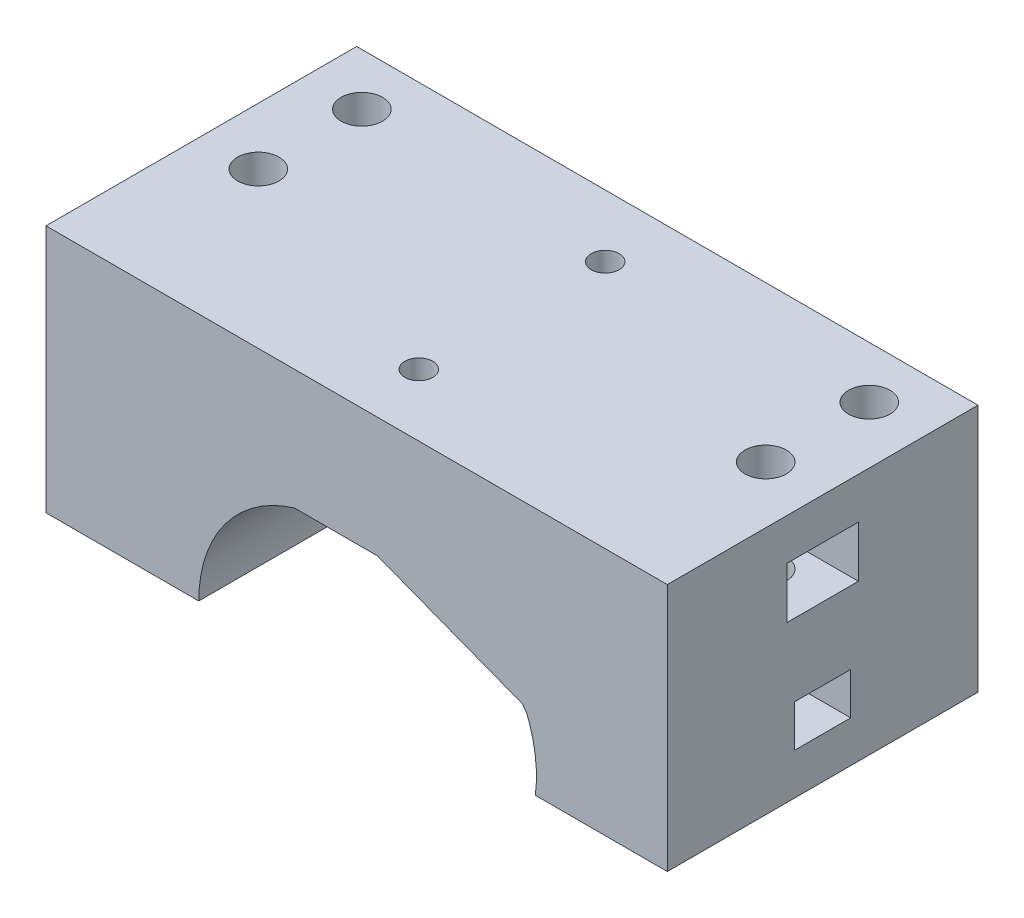
from build123d import *

# Parameters (mm, degrees)
SKETCH_1_W           = 60
SKETCH_1_H           = 34
EXTRUDE_1_DEPTH      = 30
SKETCH_17_W          = 12
SKETCH_17_H          = 23
EXTRUDE_8_DEPTH      = 80
SKETCH_18_R          = 2
CUT_EXTRUDE_7_DEPTH  = 10
CUT_EXTRUDE_8_DEPTH  = 66
SKETCH_20_W          = 4.5
SKETCH_20_H          = 17.2
CUT_EXTRUDE_9_DEPTH  = 8.8
SKETCH_14_R          = 1.6
CUT_EXTRUDE_6_DEPTH  = 103.708324882
EXTRUDE_START        = 7
SKETCH_21_W          = 60
SKETCH_21_H          = 30
SKETCH_21_R          = 1.6
EXTRUDE_9_DEPTH      = 7
SKETCH_22_W          = 36
SKETCH_22_H          = 30
EXTRUDE_10_DEPTH     = 7
SKETCH_27_W          = 12
SKETCH_27_H          = 50
CUT_EXTRUDE_13_DEPTH = 95.768138106
SKETCH_29_W          = 12
SKETCH_29_H          = 16
CUT_EXTRUDE_14_DEPTH = 71.710678119
SKETCH_36_W          = 12
SKETCH_36_H          = 23
CUT_EXTRUDE_21_DEPTH = 50
SKETCH_37_W          = 12
SKETCH_37_H          = 16
CUT_EXTRUDE_22_DEPTH = 59.309518948
SKETCH_38_W          = 60
SKETCH_38_H          = 30
CUT_EXTRUDE_23_DEPTH = 34
SKETCH_41_W          = 6.9
SKETCH_41_H          = 4.95
SKETCH_41_W_2        = 5.41
SKETCH_41_H_2        = 4.05
CUT_EXTRUDE_25_DEPTH = 5.5
CUT_EXTRUDE_26_DEPTH = 49.744230428
SKETCH_43_R          = 1.35
CUT_EXTRUDE_27_DEPTH = 49.7442306
SKETCH_47_R          = 1.9
CUT_EXTRUDE_29_DEPTH = 7
SKETCH_48_R          = 2
CUT_EXTRUDE_30_DEPTH = 10
CUT_EXTRUDE_START    = -4
SKETCH_49_R          = 2
CUT_EXTRUDE_31_DEPTH = 4.9
CUT_EXTRUDE_32_DEPTH = 4.05
CUT_EXTRUDE_33_DEPTH = 4.95
CUT_EXTRUDE_34_REACH = 50.744
SKETCH_53_R          = 2


with BuildPart() as part:
    # 草图1 → 凸台-拉伸1 (new body)
    with BuildSketch(Plane.XY):
        Rectangle(SKETCH_1_W, SKETCH_1_H)
    extrude(amount=EXTRUDE_1_DEPTH)

    # 草图17 → 凸台-拉伸8 (add)
    with BuildSketch(Plane(origin=(0, 0, 0), x_dir=(-1, 0, 0), z_dir=(0, 0, -1))):
        with Locations((24, 28.5)):
            Rectangle(SKETCH_17_W, SKETCH_17_H)
        with Locations((-24, 28.5)):
            Rectangle(SKETCH_17_W, SKETCH_17_H)
    extrude(amount=-EXTRUDE_8_DEPTH)

    # 草图18 → 切除-拉伸7 (cut)
    with BuildSketch(Plane.XY.offset(80)):
        with Locations((24.5, 34)):
            Circle(SKETCH_18_R)
        with Locations((24.5, 24)):
            Circle(SKETCH_18_R)
        with Locations((-24.5, 24)):
            Circle(SKETCH_18_R)
        with Locations((-24.5, 34)):
            Circle(SKETCH_18_R)
    extrude(amount=-CUT_EXTRUDE_7_DEPTH, mode=Mode.SUBTRACT)

    # 草图19 → 切除-拉伸8 (cut)
    with BuildSketch(Plane.XY.offset(30)):
        with BuildLine():
            Line((2, 12.4), (-6, 12.4))
            ThreePointArc((-6, 12.4), (-15.249310993, 0), (-6, -12.4))
            Line((-6, -12.4), (2, -12.4))
            Line((2, -12.4), (16.003706397, -7.024480757))
            ThreePointArc((16.003706397, -7.024480757), (17.250689007, 0), (16.003706397, 7.024480757))
            Line((16.003706397, 7.024480757), (2, 12.4))
        make_face()
    extrude(amount=-CUT_EXTRUDE_8_DEPTH, mode=Mode.SUBTRACT)

    # 草图20 → 切除-拉伸9 (cut)
    with BuildSketch(Plane(origin=(30, 0, 0), x_dir=(0, 0, -1), z_dir=(1, 0, 0))):
        with Locations((-67.75, 28.8)):
            Rectangle(SKETCH_20_W, SKETCH_20_H)
    cut_extrude_9 = extrude(amount=-CUT_EXTRUDE_9_DEPTH, mode=Mode.SUBTRACT)

    # 草图14 → 切除-拉伸6 (cut, through all)
    with BuildSketch(Plane.XZ.offset(17)):
        with Locations(Location((24.5, 15, 0), (0, 0, 270))):
            Circle(SKETCH_14_R)
        with Locations(Location((-24.5, 15, 0), (0, 0, 270))):
            Circle(SKETCH_14_R)
    extrude(amount=-CUT_EXTRUDE_6_DEPTH, mode=Mode.SUBTRACT)

    # 镜向3: 切除-拉伸9 across plane
    add(cut_extrude_9.mirror(Plane(origin=(0, 0, 0), x_dir=(0, 0, 1), z_dir=(1, 0, 0))), mode=Mode.SUBTRACT)

    # 草图21 → 凸台-拉伸9 (add)
    with BuildSketch(Plane.XZ.offset(17).offset(EXTRUDE_START)):
        with Locations((0, 15)):
            Rectangle(SKETCH_21_W, SKETCH_21_H)
        with Locations(Location((24.5, 15, 0), (0, 0, 270))):
            Circle(SKETCH_21_R, mode=Mode.SUBTRACT)
        with Locations(Location((-24.5, 15, 0), (0, 0, 270))):
            Circle(SKETCH_21_R, mode=Mode.SUBTRACT)
    extrude(amount=-EXTRUDE_9_DEPTH)

    # 草图22 → 凸台-拉伸10 (add)
    with BuildSketch(Plane(origin=(0, 17, 0), x_dir=(1, 0, 0), z_dir=(0, 1, 0))):
        with Locations((0, -15)):
            Rectangle(SKETCH_22_W, SKETCH_22_H)
    extrude(amount=EXTRUDE_10_DEPTH)

    # 草图27 → 切除-拉伸13 (cut, through all)
    with BuildSketch(Plane.XZ.offset(-17)):
        with Locations((24, 55)):
            Rectangle(SKETCH_27_W, SKETCH_27_H)
    extrude(amount=-CUT_EXTRUDE_13_DEPTH, mode=Mode.SUBTRACT)

    # 草图29 → 切除-拉伸14 (cut, through all)
    with BuildSketch(Plane.XY.offset(30)):
        with Locations((24, 32)):
            Rectangle(SKETCH_29_W, SKETCH_29_H)
    extrude(amount=-CUT_EXTRUDE_14_DEPTH, mode=Mode.SUBTRACT)

    # 草图36 → 切除-拉伸21 (cut)
    with BuildSketch(Plane.XY.offset(80)):
        with Locations((-24, 28.5)):
            Rectangle(SKETCH_36_W, SKETCH_36_H)
    extrude(amount=-CUT_EXTRUDE_21_DEPTH, mode=Mode.SUBTRACT)

    # 草图37 → 切除-拉伸22 (cut, through all)
    with BuildSketch(Plane.XY.offset(30)):
        with Locations((-24, 32)):
            Rectangle(SKETCH_37_W, SKETCH_37_H)
    extrude(amount=-CUT_EXTRUDE_22_DEPTH, mode=Mode.SUBTRACT)

    # 草图38 → 切除-拉伸23 (cut)
    with BuildSketch(Plane(origin=(0, 0, 0), x_dir=(1, 0, 0), z_dir=(0, 1, 0))):
        with Locations((0, -15)):
            Rectangle(SKETCH_38_W, SKETCH_38_H)
    extrude(amount=-CUT_EXTRUDE_23_DEPTH, mode=Mode.SUBTRACT)

    # 草图41 → 切除-拉伸25 (cut)
    with BuildSketch(Plane(origin=(30, 0, 0), x_dir=(0, 0, -1), z_dir=(1, 0, 0))):
        with Locations((-15, 17.525)):
            Rectangle(SKETCH_41_W, SKETCH_41_H)
        with Locations((-15, 6.025)):
            Rectangle(SKETCH_41_W_2, SKETCH_41_H_2)
    cut_extrude_25 = extrude(amount=-CUT_EXTRUDE_25_DEPTH, mode=Mode.SUBTRACT)

    # 镜向5: 切除-拉伸25 across plane
    add(cut_extrude_25.mirror(Plane(origin=(0, 0, 0), x_dir=(0, 0, 1), z_dir=(1, 0, 0))), mode=Mode.SUBTRACT)

    # 草图42 → 切除-拉伸26 (cut, through all)
    with BuildSketch(Plane.XY.offset(30)):
        with BuildLine():
            Line((16.003706397, 7.024480757), (14.503027832, 1.394480604))
            Line((14.503027832, 1.394480604), (17.250689007, 0))
            add(Edge.make_bspline(
                [(16.44131127, 6.418576517), (17.679905774, 3.26163083), (17.250689007, 0)],
                knots=[0, 0, 0, 1, 1, 1], degree=2))
            Line((16.44131127, 6.418576517), (16.003706397, 7.024480757))
        make_face()
    extrude(amount=-CUT_EXTRUDE_26_DEPTH, mode=Mode.SUBTRACT)

    # 草图43 → 切除-拉伸27 (cut, through all)
    with BuildSketch(Plane(origin=(0, 24, 0), x_dir=(1, 0, 0), z_dir=(0, 1, 0))):
        with Locations(Location((0, -6, 0), (0, 0, 270))):
            Circle(SKETCH_43_R)
        with Locations(Location((0, -24, 0), (0, 0, 180))):
            Circle(SKETCH_43_R)
    extrude(amount=-CUT_EXTRUDE_27_DEPTH, mode=Mode.SUBTRACT)

    # 草图47 → 切除-拉伸29 (cut)
    with BuildSketch(Plane(origin=(0, 24, 0), x_dir=(1, 0, 0), z_dir=(0, 1, 0))):
        with Locations(Location((-24.5, -15, 0), (0, 0, 270))):
            Circle(SKETCH_47_R)
        with Locations(Location((24.5, -15, 0), (0, 0, 270))):
            Circle(SKETCH_47_R)
    extrude(amount=-CUT_EXTRUDE_29_DEPTH, mode=Mode.SUBTRACT)

    # 草图48 → 切除-拉伸30 (cut)
    with BuildSketch(Plane(origin=(0, 24, 0), x_dir=(1, 0, 0), z_dir=(0, 1, 0))):
        with Locations(Location((-24.5, -5, 0), (0, 0, 270))):
            Circle(SKETCH_48_R)
        with Locations(Location((24.5, -5, 0), (0, 0, 90))):
            Circle(SKETCH_48_R)
    extrude(amount=-CUT_EXTRUDE_30_DEPTH, mode=Mode.SUBTRACT)

    # 草图49 → 切除-拉伸31 (cut)
    # profile 1 of 2: a face of its own
    with BuildSketch(Plane(origin=(0, 24, 0), x_dir=(1, 0, 0), z_dir=(0, 1, 0)).offset(CUT_EXTRUDE_START)):
        Polygon((-26.491858429, -8.45), (-22.508141571, -8.45), (-20.516283143, -5), (-22.508141571, -1.55), (-26.491858429, -1.55), (-28.483716857, -5), align=None)
        with Locations(Location((-24.5, -5, 0), (0, 0, 270))):
            Circle(SKETCH_49_R, mode=Mode.SUBTRACT)
    # profile 2 of 2: a face of its own
    with BuildSketch(Plane(origin=(0, 24, 0), x_dir=(1, 0, 0), z_dir=(0, 1, 0)).offset(CUT_EXTRUDE_START)):
        Polygon((-28.483716857, 0), (-28.483716857, -5), (-26.491858429, -1.55), (-22.508141571, -1.55), (-20.516283143, -5), (-20.516283143, 0), align=None)
    cut_extrude_31 = extrude(amount=-CUT_EXTRUDE_31_DEPTH, mode=Mode.SUBTRACT)

    # 镜向6: 切除-拉伸31 across plane
    add(cut_extrude_31.mirror(Plane(origin=(0, 0, 0), x_dir=(0, 0, 1), z_dir=(1, 0, 0))), mode=Mode.SUBTRACT)

    # 草图51 → 切除-拉伸32 (cut)
    with BuildSketch(Plane.XZ.offset(-8.05)):
        Polygon((26.061732478, 17.705), (22.938267522, 17.705), (21.376535044, 15), (22.938267522, 12.295), (26.061732478, 12.295), (27.623464956, 15), align=None)
    cut_extrude_32 = extrude(amount=CUT_EXTRUDE_32_DEPTH, mode=Mode.SUBTRACT)

    # 草图52 → 切除-拉伸33 (cut)
    with BuildSketch(Plane(origin=(0, 15.05, 0), x_dir=(1, 0, 0), z_dir=(0, 1, 0))):
        Polygon((26.491858429, -11.55), (22.508141571, -11.55), (20.516283143, -15), (22.508141571, -18.45), (26.491858429, -18.45), (28.483716857, -15), align=None)
    cut_extrude_33 = extrude(amount=CUT_EXTRUDE_33_DEPTH, mode=Mode.SUBTRACT)

    # 镜向7: 切除-拉伸32, 切除-拉伸33 across plane
    add(cut_extrude_32.mirror(Plane(origin=(0, 0, 0), x_dir=(0, 0, 1), z_dir=(1, 0, 0))), mode=Mode.SUBTRACT)
    add(cut_extrude_33.mirror(Plane(origin=(0, 0, 0), x_dir=(0, 0, 1), z_dir=(1, 0, 0))), mode=Mode.SUBTRACT)

    # 草图53 → 切除-拉伸34 (cut, up to next)
    with BuildSketch(Plane(origin=(0, 24, 0), x_dir=(1, 0, 0), z_dir=(0, 1, 0)), mode=Mode.PRIVATE) as cut_extrude_34_sk1:
        with Locations(Location((-24.5, -15, 0), (0, 0, 270))):
            Circle(SKETCH_53_R)
    cut_extrude_34_tool1 = extrude(cut_extrude_34_sk1.sketch, amount=-CUT_EXTRUDE_34_REACH, mode=Mode.PRIVATE) & part.part
    # 草图53 → 切除-拉伸34 (cut, up to next)
    with BuildSketch(Plane(origin=(0, 24, 0), x_dir=(1, 0, 0), z_dir=(0, 1, 0)), mode=Mode.PRIVATE) as cut_extrude_34_sk2:
        with Locations(Location((24.5, -15, 0), (0, 0, 270))):
            Circle(SKETCH_53_R)
    cut_extrude_34_tool2 = extrude(cut_extrude_34_sk2.sketch, amount=-CUT_EXTRUDE_34_REACH, mode=Mode.PRIVATE) & part.part
    add(cut_extrude_34_tool1.solids().sort_by_distance((-24.5, 24, 15))[0], mode=Mode.SUBTRACT)
    add(cut_extrude_34_tool1.solids().sort_by_distance((-24.5, 24, 15))[1], mode=Mode.SUBTRACT)
    add(cut_extrude_34_tool2.solids().sort_by_distance((24.5, 24, 15))[0], mode=Mode.SUBTRACT)
    add(cut_extrude_34_tool2.solids().sort_by_distance((24.5, 24, 15))[1], mode=Mode.SUBTRACT)


solid = part.part
